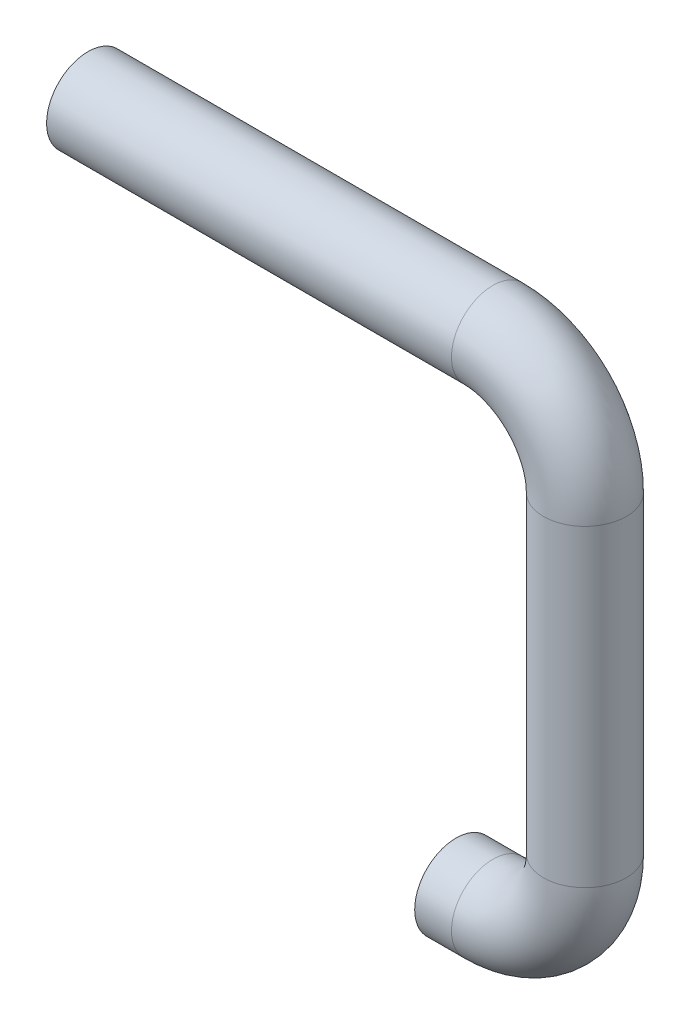
from build123d import *

# Parameters (mm, degrees)
SWEEP_THIN1_PROFILE_R    = 22.5
SWEEP_THIN1_PROFILE_R_2  = 15
BOSS_EXTRUDE1_DEPTH      = 10
BOSS_EXTRUDE1_DEPTH_BACK = 10
SKETCH6_R                = 22.5
SKETCH6_R_2              = 21


with BuildPart() as part:
    # Sweep-Thin1: sweep along a path in Sketch1
    with BuildLine(Plane.XY) as sweep_thin1_path:
        Line((0, 0), (220, 0))
        ThreePointArc((220, 0), (255.355339059, -14.644660941), (270, -50))
        Line((270, -50), (270, -220))
        ThreePointArc((270, -220), (255.355339059, -255.355339059), (220, -270))
        Line((220, -270), (210, -270))
    # Sweep-Thin1 profile (on start of the path) → Sweep-Thin1 (sweep)
    with BuildSketch(Plane(origin=(0, 0, 0), x_dir=(0, 0, 1), z_dir=(1, 0, 0))):
        Circle(SWEEP_THIN1_PROFILE_R)
        Circle(SWEEP_THIN1_PROFILE_R_2, mode=Mode.SUBTRACT)
    sweep(path=sweep_thin1_path.line)

    # Sketch6 → Boss-Extrude1 (add, two sides: drawn at the far end of the back side and taken through both)
    with BuildSketch(Plane.ZY.offset(-210).offset(-BOSS_EXTRUDE1_DEPTH_BACK)):
        with Locations((0, -270)):
            Circle(SKETCH6_R)
        with Locations((0, -270)):
            Circle(SKETCH6_R_2, mode=Mode.SUBTRACT)
    extrude(amount=BOSS_EXTRUDE1_DEPTH + BOSS_EXTRUDE1_DEPTH_BACK)


solid = part.part
